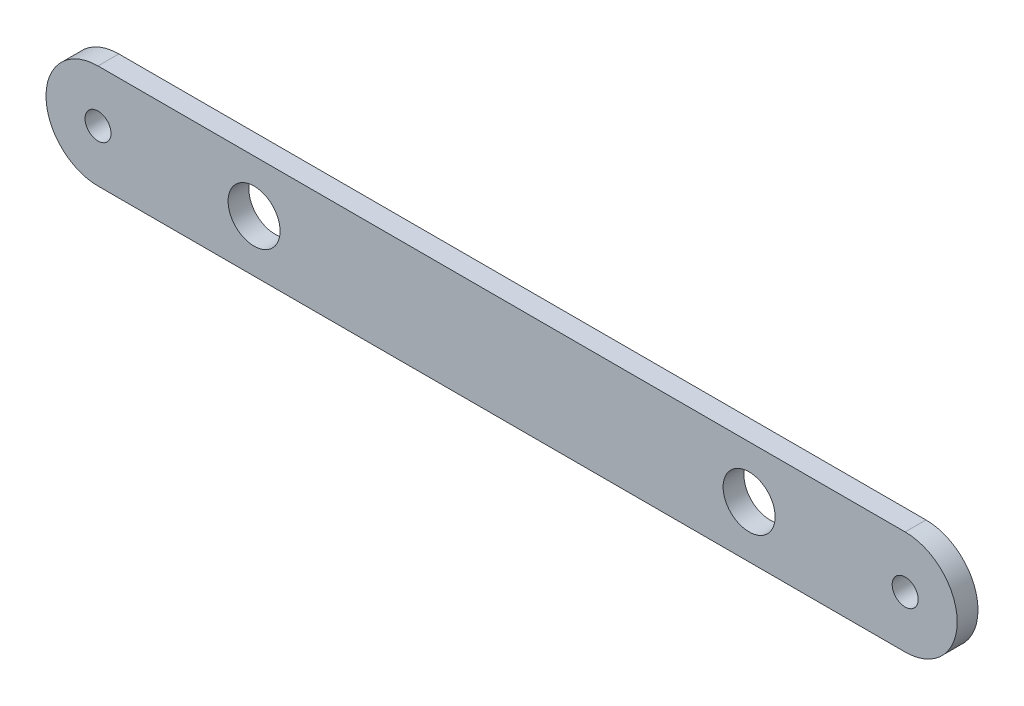
from build123d import *

# Parameters (mm, degrees)
SKETCH1_R           = 6.35
SKETCH1_R_2         = 1.5875
SKETCH1_R_3         = 3.175
BOSS_EXTRUDE1_DEPTH = 2.54


with BuildPart() as part:
    # Sketch1 → Boss-Extrude1 (new body)
    # profile 1 of 3: a face of its own
    with BuildSketch(Plane.XY):
        Circle(SKETCH1_R)
        Circle(SKETCH1_R_2, mode=Mode.SUBTRACT)
    # profile 2 of 3: a face of its own
    with BuildSketch(Plane.XY):
        with BuildLine():
            Line((98.5266, 6.35), (0, 6.35))
            ThreePointArc((0, 6.35), (4.490128061, 4.490128061), (6.35, 0))
            ThreePointArc((6.35, 0), (4.490128061, -4.490128061), (0, -6.35))
            Line((0, -6.35), (98.5266, -6.35))
            ThreePointArc((98.5266, -6.35), (92.1766, 0), (98.5266, 6.35))
        make_face()
        with Locations((19.05, 0)):
            Circle(SKETCH1_R_3, mode=Mode.SUBTRACT)
        with Locations((79.4766, 0)):
            Circle(SKETCH1_R_3, mode=Mode.SUBTRACT)
    # profile 3 of 3: a face of its own
    with BuildSketch(Plane.XY):
        with Locations((98.5266, 0)):
            Circle(SKETCH1_R)
        with Locations((98.5266, 0)):
            Circle(SKETCH1_R_2, mode=Mode.SUBTRACT)
    extrude(amount=BOSS_EXTRUDE1_DEPTH)


solid = part.part
